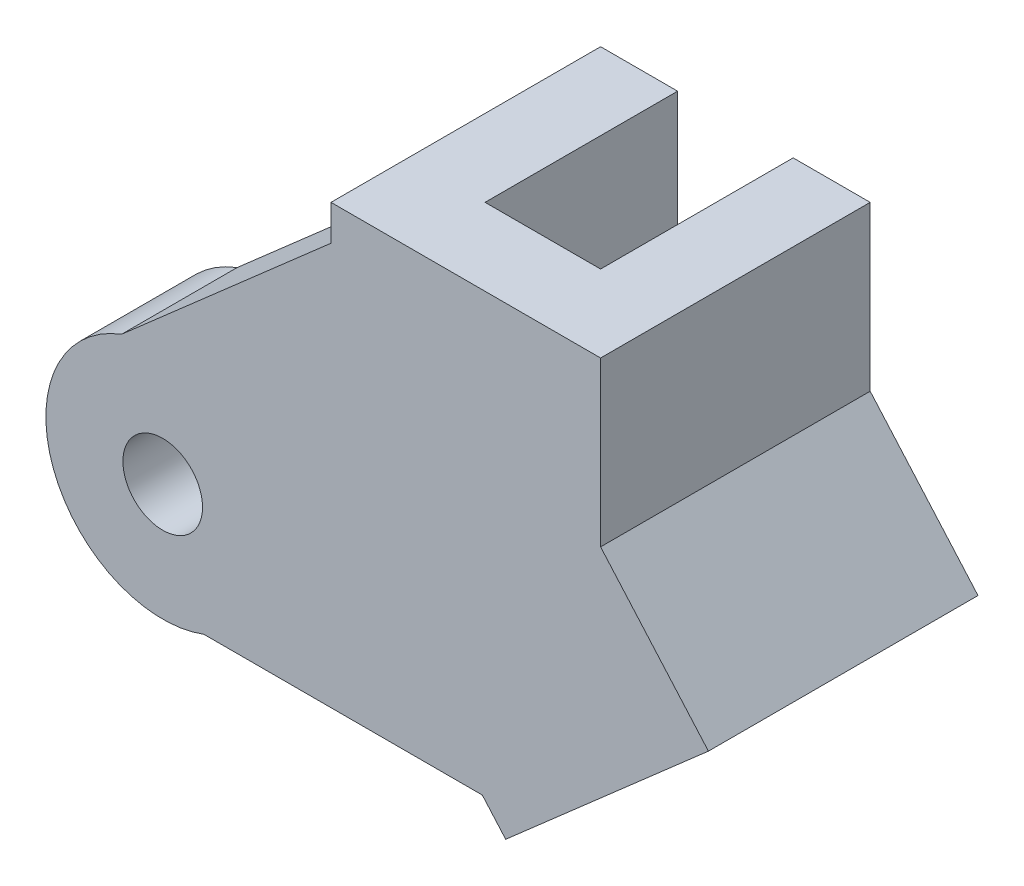
from build123d import *

# Parameters (mm, degrees)
BOSS_EXTRUDE1_DEPTH   = 5
BOSS_EXTRUDE1_2_DEPTH = 5
BOSS_EXTRUDE2_DEPTH   = 2
SKETCH3_R             = 1.033864096
BOSS_EXTRUDE3_DEPTH   = 3


with BuildPart() as part:
    # Sketch1 → Boss-Extrude1 (new body)
    with BuildSketch(Plane.XY):
        Polygon((-10.505514799, 35.409303061), (-7.209900565, 31.649126626), (-5.705829991, 32.967372319), (-8.505514799, 36.161711248), (-8.505514799, 40.409303061), (-10.505514799, 40.409303061), align=None)
    extrude(amount=-BOSS_EXTRUDE1_DEPTH)



with BuildPart() as body_2:
    # Sketch1 → Boss-Extrude1 2 (new body)
    with BuildSketch(Plane.XY):
        Polygon((-13.505514799, 34.280690781), (-9.466006426, 29.671758086), (-10.970077001, 28.353512393), (-15.505514799, 33.528282595), (-15.505514799, 40.409303061), (-13.505514799, 40.409303061), align=None)
    extrude(amount=-BOSS_EXTRUDE1_2_DEPTH)


with BuildPart() as part_1:
    add(part.part)

    add(body_2.part)  # Boss-Extrude2 merges body 2
    # Sketch2 → Boss-Extrude2 (add)
    with BuildSketch(Plane.XY):
        Polygon((-10.970077001, 28.353512393), (-5.705829991, 32.967372319), (-8.505514799, 36.161711248), (-8.505514799, 40.409303061), (-15.505514799, 40.409303061), (-15.505514799, 33.528282595), align=None)
    extrude(amount=BOSS_EXTRUDE2_DEPTH)

    # Sketch3 → Boss-Extrude3 (add)
    with BuildSketch(Plane.XY.offset(2)):
        with BuildLine():
            Line((-11.57598817, 29.044835084), (-15.505514799, 33.528282595))
            Line((-15.505514799, 33.528282595), (-15.505514799, 39.490034108))
            Line((-15.505514799, 39.490034108), (-20.943415916, 34.723974688))
            ThreePointArc((-20.943415916, 34.723974688), (-22.714727935, 30.816147103), (-18.80690035, 29.044835084))
            Line((-18.80690035, 29.044835084), (-11.57598817, 29.044835084))
        make_face()
        with Locations((-19.875158133, 31.884404886)):
            Circle(SKETCH3_R, mode=Mode.SUBTRACT)
    extrude(amount=-BOSS_EXTRUDE3_DEPTH)


solid = part_1.part
